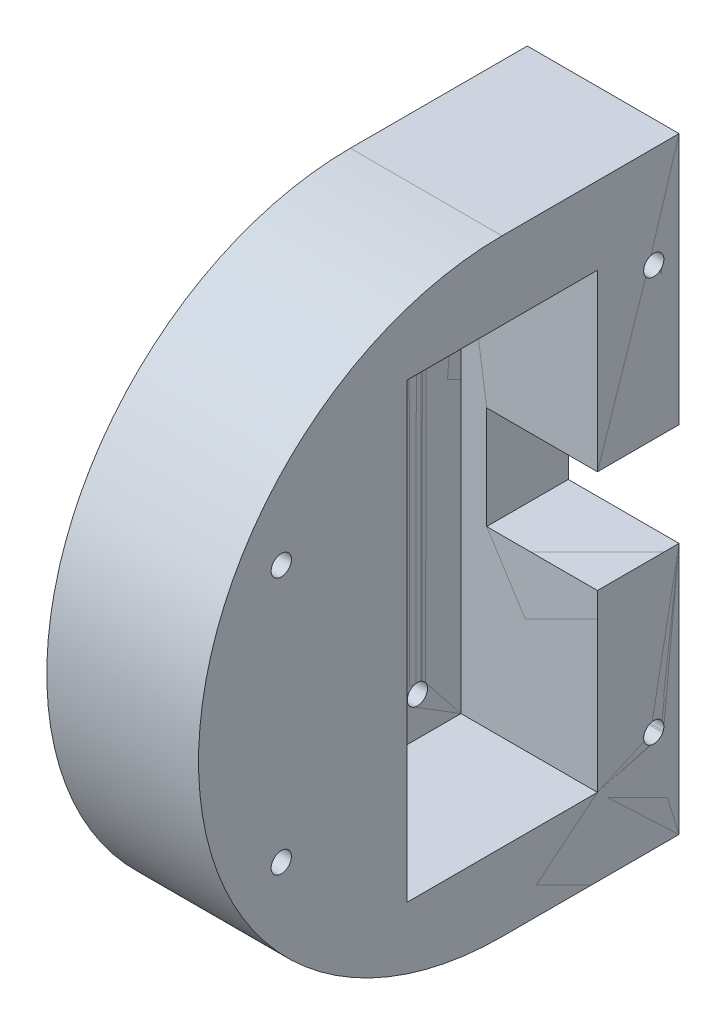
from build123d import *

# Parameters (mm, degrees)
RESSALTO_EXTRUS_O9_DEPTH      = 12.5
RESSALTO_EXTRUS_O9_DEPTH_BACK = 5
ESBO_O34_W                    = 15
ESBO_O34_H                    = 60
RESSALTO_EXTRUS_O10_DEPTH     = 15
ESBO_O36_R                    = 1
CORTE_EXTRUS_O18_DEPTH        = 20
ESBO_O39_W                    = 18.85
ESBO_O39_H                    = 44.705
CORTE_EXTRUS_O20_DEPTH        = 13.49
ESBO_O43_W                    = 10.95
ESBO_O43_H                    = 10.16
CORTE_EXTRUS_O23_DEPTH        = 10
CORTE_EXTRUS_O33_DEPTH        = 20
CORTE_EXTRUS_O33_DEPTH_BACK   = 10
ESBO_O41_R                    = 1.6255
ESBO_O41_R_2                  = 1
ESBO_O42_R                    = 1.6255
ESBO_O42_R_2                  = 1
CORTE_EXTRUS_O34_DEPTH        = 20
ESBO_O62_R                    = 1
CORTE_EXTRUS_O35_DEPTH        = 20


with BuildPart() as part:
    # Esboço34 → Ressalto-extrusão9 (new, two sides: drawn at the far end of the back side and taken through both)
    with BuildSketch(Plane.XY.offset(5).offset(-RESSALTO_EXTRUS_O9_DEPTH_BACK)):
        with Locations((62.689074272, -19.514497041)):
            Rectangle(ESBO_O34_W, ESBO_O34_H)
    extrude(amount=RESSALTO_EXTRUS_O9_DEPTH + RESSALTO_EXTRUS_O9_DEPTH_BACK)


with BuildPart() as body_2:
    # Esboço35 → Ressalto-extrusão10 (new body)
    with BuildSketch(Plane(origin=(70.189074272, 0, 0), x_dir=(0, 0, -1), z_dir=(1, 0, 0))):
        with BuildLine():
            Line((0, 10.485502959), (-17.5, 10.485502959))
            ThreePointArc((-17.5, 10.485502959), (-47.5, -19.514497041), (-17.5, -49.514497041))
            Line((-17.5, -49.514497041), (0, -49.514497041))
            Line((0, -49.514497041), (0, 10.485502959))
        make_face()
    extrude(amount=-RESSALTO_EXTRUS_O10_DEPTH)


with BuildPart() as corte_extrus_o18_tool:
    # Esboço36 → Corte-extrusão18 (new body)
    with BuildSketch(Plane(origin=(70.189074272, 0, 0), x_dir=(0, 0, -1), z_dir=(1, 0, 0))):
        with Locations((-2.5, -39.514497041)):
            Circle(ESBO_O36_R)
        with Locations((-2.5, 0.485502959)):
            Circle(ESBO_O36_R)
    extrude(amount=-CORTE_EXTRUS_O18_DEPTH)


with BuildPart() as part_1:
    add(part.part)

    # Corte-extrusão18: cut by corte_extrus_o18_tool
    add(corte_extrus_o18_tool.part, mode=Mode.SUBTRACT)


with BuildPart() as body_2_1:
    add(body_2.part)

    # Corte-extrusão18: cut by corte_extrus_o18_tool
    add(corte_extrus_o18_tool.part, mode=Mode.SUBTRACT)


with BuildPart() as corte_extrus_o20_tool:
    # Esboço39 → Corte-extrusão20 (new body)
    with BuildSketch(Plane(origin=(70.189074272, 0, 0), x_dir=(0, 0, -1), z_dir=(1, 0, 0))):
        with Locations((-17.491326567, -19.523544175)):
            Rectangle(ESBO_O39_W, ESBO_O39_H)
    extrude(amount=-CORTE_EXTRUS_O20_DEPTH)


with BuildPart() as part_2:
    add(part_1.part)

    # Corte-extrusão20: cut by corte_extrus_o20_tool
    add(corte_extrus_o20_tool.part, mode=Mode.SUBTRACT)


with BuildPart() as body_2_2:
    add(body_2_1.part)

    # Corte-extrusão20: cut by corte_extrus_o20_tool
    add(corte_extrus_o20_tool.part, mode=Mode.SUBTRACT)


with BuildPart() as corte_extrus_o23_tool:
    # Esboço43 → Corte-extrusão23 (new body)
    with BuildSketch(Plane.XY.offset(8.066326567)):
        with Locations((64.714074272, -19.514497041)):
            Rectangle(ESBO_O43_W, ESBO_O43_H)
    extrude(amount=-CORTE_EXTRUS_O23_DEPTH)


with BuildPart() as part_3:
    add(part_2.part)

    # Corte-extrusão23: cut by corte_extrus_o23_tool
    add(corte_extrus_o23_tool.part, mode=Mode.SUBTRACT)


with BuildPart() as body_2_3:
    add(body_2_2.part)

    # Corte-extrusão23: cut by corte_extrus_o23_tool
    add(corte_extrus_o23_tool.part, mode=Mode.SUBTRACT)


with BuildPart() as corte_extrus_o33_tool:
    # Esboço41 → Corte-extrusão33 (new, two sides: drawn at the far end of the back side and taken through both)
    with BuildSketch(Plane(origin=(56.699074272, 0, 0), x_dir=(0, 0, -1), z_dir=(1, 0, 0)).offset(-CORTE_EXTRUS_O33_DEPTH_BACK)):
        with Locations(Location((-20.375326567, -0.981044175, 0), (0, 0, 180))):
            Circle(ESBO_O41_R)
        with Locations(Location((-12.375326567, -0.981044175, 0), (0, 0, 180))):
            Circle(ESBO_O41_R_2)
    extrude(amount=CORTE_EXTRUS_O33_DEPTH + CORTE_EXTRUS_O33_DEPTH_BACK)


with BuildPart() as part_4:
    add(part_3.part)

    # Corte-extrusão33: cut by corte_extrus_o33_tool
    add(corte_extrus_o33_tool.part, mode=Mode.SUBTRACT)


with BuildPart() as body_2_4:
    add(body_2_3.part)

    # Corte-extrusão33: cut by corte_extrus_o33_tool
    add(corte_extrus_o33_tool.part, mode=Mode.SUBTRACT)


with BuildPart() as corte_extrus_o34_tool:
    # Esboço42 → Corte-extrusão34 (new body)
    with BuildSketch(Plane(origin=(56.699074272, 0, 0), x_dir=(0, 0, -1), z_dir=(1, 0, 0))):
        with Locations((-20.375326567, -38.066044175)):
            Circle(ESBO_O42_R)
        with Locations((-12.375326567, -38.066044175)):
            Circle(ESBO_O42_R_2)
    extrude(amount=-CORTE_EXTRUS_O34_DEPTH)


with BuildPart() as part_5:
    add(part_4.part)

    # Corte-extrusão34: cut by corte_extrus_o34_tool
    add(corte_extrus_o34_tool.part, mode=Mode.SUBTRACT)


with BuildPart() as body_2_5:
    add(body_2_4.part)

    # Corte-extrusão34: cut by corte_extrus_o34_tool
    add(corte_extrus_o34_tool.part, mode=Mode.SUBTRACT)

    # Esboço62 → Corte-extrusão35 (cut)
    with BuildSketch(Plane(origin=(70.189074272, 0, 0), x_dir=(0, 0, -1), z_dir=(1, 0, 0))):
        with Locations(Location((-39.32, -32.229996518, 0), (0, 0, 90))):
            Circle(ESBO_O62_R)
        with Locations(Location((-39.32, -6.799454191, 0), (0, 0, 90))):
            Circle(ESBO_O62_R)
    extrude(amount=-CORTE_EXTRUS_O35_DEPTH, mode=Mode.SUBTRACT)


solid = Compound([part_5.part, body_2_5.part])
